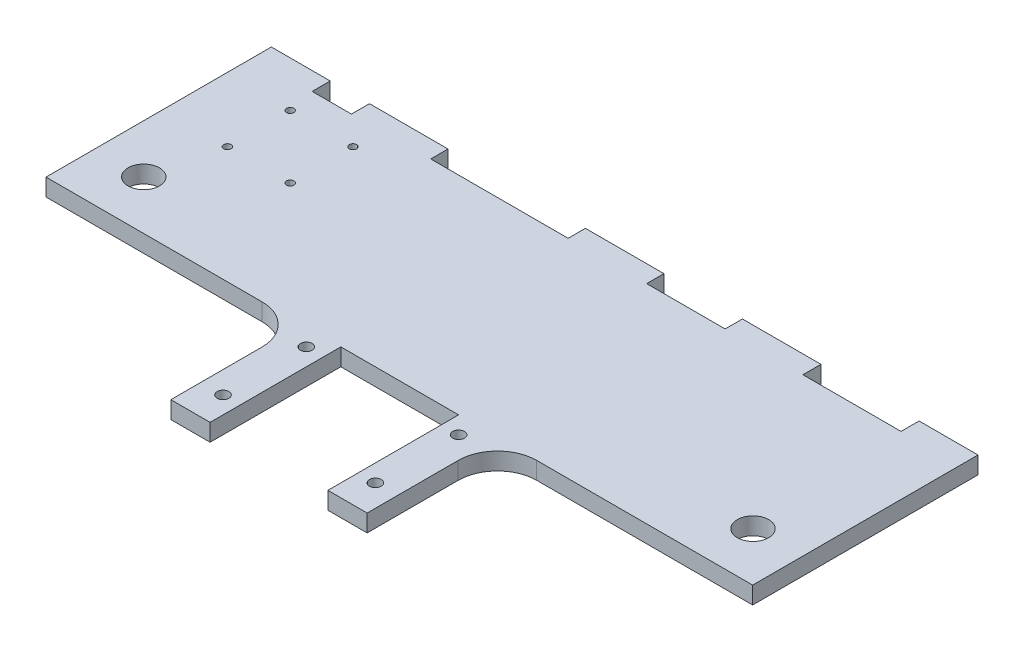
from build123d import *

# Parameters (mm, degrees)
BOSS_EXTRUDE1_DEPTH   = 5.588
F_6_CLEARANCE_HOLE1_D = 3.7973
M2_CLEARANCE_HOLE1_D  = 2.4
CUT_EXTRUDE1_REACH    = 254.133
SKETCH8_R             = 5.08


with BuildPart() as part:
    # Sketch1 → Boss-Extrude1 (new body)
    with BuildSketch(Plane(origin=(0, 0, 0), x_dir=(1, 0, 0), z_dir=(0, 1, 0))):
        with BuildLine():
            Line((12.7, 72.898), (31.75, 72.898))
            Line((31.75, 72.898), (31.75, 67.056))
            Line((31.75, 67.056), (44.45, 67.056))
            Line((44.45, 67.056), (44.45, 72.898))
            Line((44.45, 72.898), (69.85, 72.898))
            Line((69.85, 72.898), (69.85, 67.31))
            Line((69.85, 67.31), (114.3, 67.31))
            Line((114.3, 67.31), (114.3, 72.898))
            Line((114.3, 72.898), (139.7, 72.898))
            Line((139.7, 72.898), (139.7, 67.31))
            Line((139.7, 67.31), (165.1, 67.31))
            Line((165.1, 67.31), (165.1, 72.898))
            Line((165.1, 72.898), (190.5, 72.898))
            Line((190.5, 72.898), (190.5, 67.056))
            Line((190.5, 67.056), (222.25, 67.056))
            Line((222.25, 67.056), (222.25, 72.898))
            Line((222.25, 72.898), (241.3, 72.898))
            Line((241.3, 72.898), (241.3, 0))
            Line((241.3, 0), (171.45, 0))
            ThreePointArc((171.45, 0), (162.469743879, -3.719743879), (158.75, -12.7))
            Line((158.75, -12.7), (158.75, -42.164))
            Line((158.75, -42.164), (146.05, -42.164))
            Line((146.05, -42.164), (146.05, 0.122766638))
            Line((146.05, 0.122766638), (127, 0.122766638))
            Line((127, 0.122766638), (107.95, 0.122766638))
            Line((107.95, 0.122766638), (107.95, -42.164))
            Line((107.95, -42.164), (95.25, -42.164))
            Line((95.25, -42.164), (95.25, -12.7))
            ThreePointArc((95.25, -12.7), (91.530256121, -3.719743879), (82.55, 0))
            Line((82.55, 0), (12.7, 0))
            Line((12.7, 0), (12.7, 72.898))
        make_face()
    extrude(amount=BOSS_EXTRUDE1_DEPTH)

    # #6 Clearance Hole1 (through all)
    with Locations(Plane(origin=(0, 0, 0), x_dir=(-1, 0, 0), z_dir=(0, -1, 0))):
        with Locations((-102.362, -32.397617544), (-151.638, -32.397617544), (-151.638, -5.456849181), (-102.362, -5.456849181)):
            Hole(F_6_CLEARANCE_HOLE1_D / 2)

    # M2 Clearance Hole1 (through all)
    with Locations(Plane(origin=(0, 5.588, 0), x_dir=(1, 0, 0), z_dir=(0, 1, 0))):
        with Locations((33.528, 58.166), (53.848, 58.166), (53.848, 37.846), (33.528, 37.846)):
            Hole(M2_CLEARANCE_HOLE1_D / 2)

    # Sketch8 → Cut-Extrude1 (cut, up to next)
    with BuildSketch(Plane(origin=(0, 5.588, 0), x_dir=(1, 0, 0), z_dir=(0, 1, 0)), mode=Mode.PRIVATE) as cut_extrude1_sk1:
        with Locations(Location((28.448, 15.870766638, 0), (0, 0, 270))):
            Circle(SKETCH8_R)
    cut_extrude1_tool1 = extrude(cut_extrude1_sk1.sketch, amount=-CUT_EXTRUDE1_REACH, mode=Mode.PRIVATE) & part.part
    # Sketch8 → Cut-Extrude1 (cut, up to next)
    with BuildSketch(Plane(origin=(0, 5.588, 0), x_dir=(1, 0, 0), z_dir=(0, 1, 0)), mode=Mode.PRIVATE) as cut_extrude1_sk2:
        with Locations(Location((225.552, 15.870766638, 0), (0, 0, 270))):
            Circle(SKETCH8_R)
    cut_extrude1_tool2 = extrude(cut_extrude1_sk2.sketch, amount=-CUT_EXTRUDE1_REACH, mode=Mode.PRIVATE) & part.part
    add(cut_extrude1_tool1.solids().sort_by_distance((28.448, 5.588, -15.870767))[0], mode=Mode.SUBTRACT)
    add(cut_extrude1_tool2.solids().sort_by_distance((225.552, 5.588, -15.870767))[0], mode=Mode.SUBTRACT)


solid = part.part
